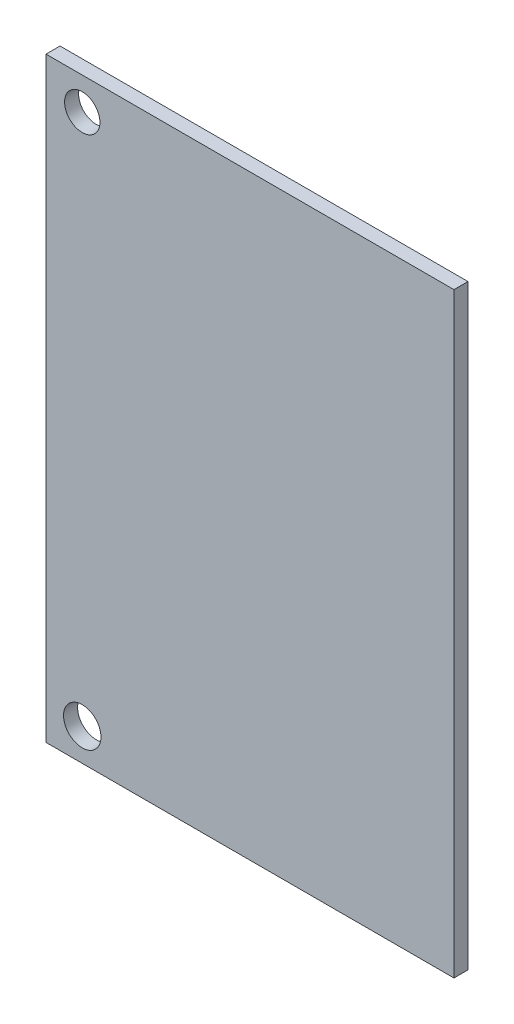
from build123d import *

# Parameters (mm, degrees)
SKETCH_1_W          = 69.8
SKETCH_1_H          = 51
SKETCH_1_R          = 1.512119171
SKETCH_1_R_2        = 1.6
EXTRUDE_1_DEPTH     = 1.2
SKETCH_2_W          = 34.9
SKETCH_2_H          = 51
CUT_EXTRUDE_1_DEPTH = 342.65045794


with BuildPart() as part:
    # Эскиз1 → Бобышка-Вытянуть1 (new body)
    with BuildSketch(Plane.XY):
        with Locations((-305.123327031, 7.782615371)):
            Rectangle(SKETCH_1_W, SKETCH_1_H)
        with Locations((-336.923327031, 30.532615371)):
            Circle(SKETCH_1_R, mode=Mode.SUBTRACT)
        with Locations((-336.923327031, -14.967384629)):
            Circle(SKETCH_1_R_2, mode=Mode.SUBTRACT)
        with Locations((-273.323327031, 30.532615371)):
            Circle(SKETCH_1_R_2, mode=Mode.SUBTRACT)
        with Locations((-273.323327031, -14.967384629)):
            Circle(SKETCH_1_R_2, mode=Mode.SUBTRACT)
    extrude(amount=EXTRUDE_1_DEPTH)

    # Эскиз2 → Вырез-Вытянуть1 (cut, through all)
    with BuildSketch(Plane.XY.offset(1.2)):
        with Locations((-287.673327031, 7.782615371)):
            Rectangle(SKETCH_2_W, SKETCH_2_H)
    extrude(amount=-CUT_EXTRUDE_1_DEPTH, mode=Mode.SUBTRACT)


solid = part.part
